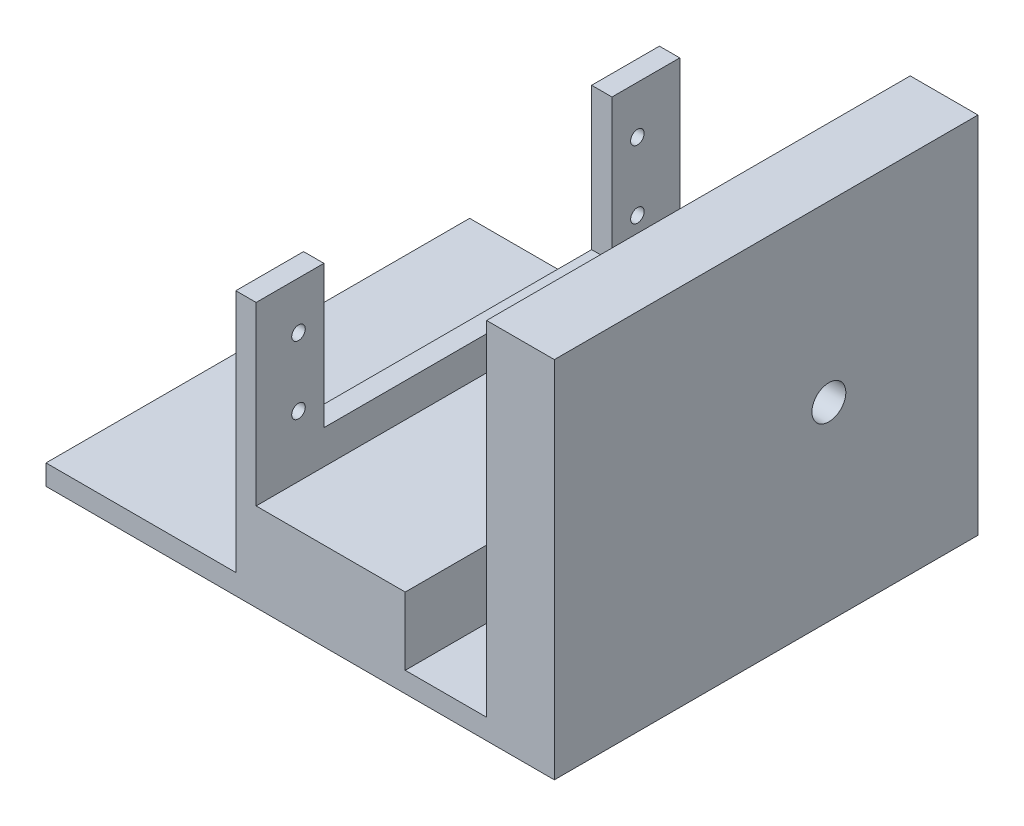
from build123d import *

# Parameters (mm, degrees)
SKETCH1_W           = 99
SKETCH1_H           = 62.5
BOSS_EXTRUDE1_DEPTH = 53.7
SKETCH2_W           = 79
SKETCH2_H           = 62.5
CUT_EXTRUDE1_DEPTH  = 50.7
SKETCH3_W           = 25
SKETCH3_H           = 62.5
BOSS_EXTRUDE2_DEPTH = 10
BOSS_EXTRUDE4_DEPTH = 3
SKETCH5_W           = 24
SKETCH5_H           = 62.5
CUT_EXTRUDE3_DEPTH  = 72
CUT_EXTRUDE4_REACH  = 96.863
SKETCH6_R           = 1
SKETCH7_R           = 2.5
CUT_EXTRUDE5_DEPTH  = 72


with BuildPart() as part:
    # Sketch1 → Boss-Extrude1 (new body)
    with BuildSketch(Plane(origin=(0, 0, 0), x_dir=(1, 0, 0), z_dir=(0, 1, 0))):
        with Locations((49.5, 31.25)):
            Rectangle(SKETCH1_W, SKETCH1_H)
    extrude(amount=BOSS_EXTRUDE1_DEPTH)

    # Sketch2 → Cut-Extrude1 (cut)
    with BuildSketch(Plane(origin=(0, 53.7, 0), x_dir=(1, 0, 0), z_dir=(0, 1, 0))):
        with Locations((49.5, 31.25)):
            Rectangle(SKETCH2_W, SKETCH2_H)
    extrude(amount=-CUT_EXTRUDE1_DEPTH, mode=Mode.SUBTRACT)

    # Sketch3 → Boss-Extrude2 (add)
    with BuildSketch(Plane(origin=(0, 3, 0), x_dir=(1, 0, 0), z_dir=(0, 1, 0))):
        with Locations((64.5, 31.25)):
            Rectangle(SKETCH3_W, SKETCH3_H)
    extrude(amount=BOSS_EXTRUDE2_DEPTH)

    # Sketch4 → Boss-Extrude4 (add)
    with BuildSketch(Plane.ZY.offset(-52)):
        Polygon((-62.5, 13), (-62.5, 39), (-52.5, 39), (-52.5, 18), (-10, 18), (-10, 39), (0, 39), (0, 13), align=None)
    extrude(amount=-BOSS_EXTRUDE4_DEPTH)

    # Sketch5 → Cut-Extrude3 (cut)
    with BuildSketch(Plane.XZ):
        with Locations((12, -31.25)):
            Rectangle(SKETCH5_W, SKETCH5_H)
    extrude(amount=-CUT_EXTRUDE3_DEPTH, mode=Mode.SUBTRACT)

    # Sketch6 → Cut-Extrude4 (cut, up to next)
    with BuildSketch(Plane.ZY.offset(-52), mode=Mode.PRIVATE) as cut_extrude4_sk1:
        with Locations((-56.25, 32)):
            Circle(SKETCH6_R)
    cut_extrude4_tool1 = extrude(cut_extrude4_sk1.sketch, amount=-CUT_EXTRUDE4_REACH, mode=Mode.PRIVATE) & part.part
    # Sketch6 → Cut-Extrude4 (cut, up to next)
    with BuildSketch(Plane.ZY.offset(-52), mode=Mode.PRIVATE) as cut_extrude4_sk2:
        with Locations((-56.25, 22)):
            Circle(SKETCH6_R)
    cut_extrude4_tool2 = extrude(cut_extrude4_sk2.sketch, amount=-CUT_EXTRUDE4_REACH, mode=Mode.PRIVATE) & part.part
    # Sketch6 → Cut-Extrude4 (cut, up to next)
    with BuildSketch(Plane.ZY.offset(-52), mode=Mode.PRIVATE) as cut_extrude4_sk3:
        with Locations((-6.25, 22)):
            Circle(SKETCH6_R)
    cut_extrude4_tool3 = extrude(cut_extrude4_sk3.sketch, amount=-CUT_EXTRUDE4_REACH, mode=Mode.PRIVATE) & part.part
    # Sketch6 → Cut-Extrude4 (cut, up to next)
    with BuildSketch(Plane.ZY.offset(-52), mode=Mode.PRIVATE) as cut_extrude4_sk4:
        with Locations((-6.25, 32)):
            Circle(SKETCH6_R)
    cut_extrude4_tool4 = extrude(cut_extrude4_sk4.sketch, amount=-CUT_EXTRUDE4_REACH, mode=Mode.PRIVATE) & part.part
    add(cut_extrude4_tool1.solids().sort_by_distance((52, 32, -56.25))[0], mode=Mode.SUBTRACT)
    add(cut_extrude4_tool2.solids().sort_by_distance((52, 22, -56.25))[0], mode=Mode.SUBTRACT)
    add(cut_extrude4_tool3.solids().sort_by_distance((52, 22, -6.25))[0], mode=Mode.SUBTRACT)
    add(cut_extrude4_tool4.solids().sort_by_distance((52, 32, -6.25))[0], mode=Mode.SUBTRACT)

    # Sketch7 → Cut-Extrude5 (cut)
    with BuildSketch(Plane(origin=(99, 0, 0), x_dir=(0, 0, -1), z_dir=(1, 0, 0))):
        with Locations((40.5, 28)):
            Circle(SKETCH7_R)
    extrude(amount=-CUT_EXTRUDE5_DEPTH, mode=Mode.SUBTRACT)


solid = part.part
